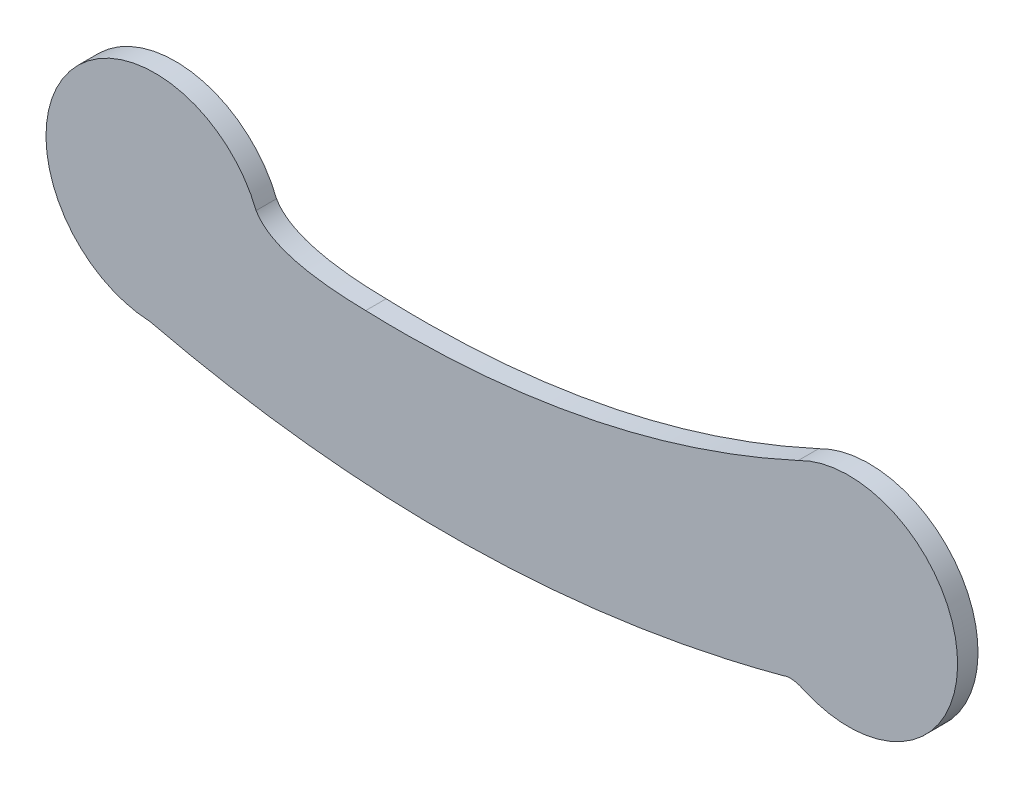
from build123d import *

# Parameters (mm, degrees)
SKETCH1_R           = 5
SKETCH1_R_2         = 1.1
SKETCH1_R_3         = 4
BOSS_EXTRUDE1_DEPTH = 3


with BuildPart() as part:
    # Sketch1 → Boss-Extrude1 (new body)
    # profile 1 of 19: a face of its own
    with BuildSketch(Plane.XY):
        with BuildLine():
            ThreePointArc((68.935876888, -41.399946265), (91.352405248, -26.204284986), (67.957252813, -12.563327983))
            add(Edge.make_bspline(
                [(67.957252813, -12.563327983), (65.455609859, -13.713888582), (60.364787712, -15.882927404), (52.683559955, -18.641296662), (44.896066709, -20.933273776), (37.015370972, -22.752952432), (29.033864031, -24.103049266), (20.950849492, -24.983508442), (14.12359191, -25.325141054), (8.614596461, -25.364124484), (5.82883012, -25.303122311), (4.440642397, -25.254725163)],
                knots=[0.003418543, 0.003418543, 0.003418543, 0.003418543, 0.119867337, 0.236316132, 0.352764926, 0.46921372, 0.585662514, 0.702111309, 0.818560103, 0.8767845, 0.935008897, 0.935008897, 0.935008897, 0.935008897], degree=3))
            add(Edge.make_bspline(
                [(-11.658277887, -20.5832063), (-9.065688302, -25.060046308), (4.440642397, -25.254725163)],
                knots=[0, 0, 0, 1, 1, 1], degree=2))
            ThreePointArc((-11.658277887, -20.5832063), (-39.551034339, -17.233624375), (-27.264419704, -42.497524754))
            add(Edge.make_bspline(
                [(-27.264419704, -42.497524754), (-25.334460253, -42.955768201), (-21.452320642, -43.816124737), (-13.705385842, -45.286858174), (-4.006421964, -46.667533574), (7.638269658, -47.586831656), (19.289241844, -47.768762722), (30.941925955, -47.212824411), (42.591601286, -45.920000504), (52.298162816, -44.228522597), (60.052175742, -42.510146288), (63.940283625, -41.52535362), (65.871739475, -41.00572578)],
                knots=[0.004189422, 0.004189422, 0.004189422, 0.004189422, 0.066427583, 0.128665745, 0.253142067, 0.377618389, 0.502094711, 0.626571033, 0.751047356, 0.875523678, 0.937761839, 1, 1, 1, 1], degree=3))
            add(Edge.make_bspline(
                [(68.935876888, -41.399946265), (67.056778784, -40.529280178), (65.871739475, -41.00572578)],
                knots=[0, 0, 0, 1, 1, 1], degree=2))
        make_face()
        with Locations((75.361610976, -26.74696222)):
            Circle(SKETCH1_R, mode=Mode.SUBTRACT)
        with Locations((75.361610976, -18.74696222)):
            Circle(SKETCH1_R_2, mode=Mode.SUBTRACT)
        with Locations((81.018465226, -21.090107971)):
            Circle(SKETCH1_R_2, mode=Mode.SUBTRACT)
        with Locations((83.361610976, -26.74696222)):
            Circle(SKETCH1_R_2, mode=Mode.SUBTRACT)
        with Locations((-26.518107506, -26.514939916)):
            Circle(SKETCH1_R_3, mode=Mode.SUBTRACT)
        with Locations((81.018465226, -32.40381647)):
            Circle(SKETCH1_R_2, mode=Mode.SUBTRACT)
        with Locations((-26.516504294, -18.516504294)):
            Circle(SKETCH1_R_2, mode=Mode.SUBTRACT)
        with Locations((-20.859650045, -20.859650045)):
            Circle(SKETCH1_R_2, mode=Mode.SUBTRACT)
        with Locations((-18.516504294, -26.516504294)):
            Circle(SKETCH1_R_2, mode=Mode.SUBTRACT)
        with Locations((-20.859650045, -32.173358544)):
            Circle(SKETCH1_R_2, mode=Mode.SUBTRACT)
        with Locations((-26.516504294, -34.516504294)):
            Circle(SKETCH1_R_2, mode=Mode.SUBTRACT)
        with Locations((-32.173358544, -32.173358544)):
            Circle(SKETCH1_R_2, mode=Mode.SUBTRACT)
        with Locations((-34.516504294, -26.516504294)):
            Circle(SKETCH1_R_2, mode=Mode.SUBTRACT)
        with Locations((-32.173358544, -20.859650045)):
            Circle(SKETCH1_R_2, mode=Mode.SUBTRACT)
        with Locations((75.361610976, -34.74696222)):
            Circle(SKETCH1_R_2, mode=Mode.SUBTRACT)
        with Locations((69.704756727, -32.40381647)):
            Circle(SKETCH1_R_2, mode=Mode.SUBTRACT)
        with Locations((67.361610976, -26.74696222)):
            Circle(SKETCH1_R_2, mode=Mode.SUBTRACT)
        with Locations((69.704756727, -21.090107971)):
            Circle(SKETCH1_R_2, mode=Mode.SUBTRACT)
    # profile 2 of 19: a face of its own
    with BuildSketch(Plane.XY):
        with Locations((-20.859650045, -20.859650045)):
            Circle(SKETCH1_R_2)
    # profile 3 of 19: a face of its own
    with BuildSketch(Plane.XY):
        with Locations((-26.516504294, -18.516504294)):
            Circle(SKETCH1_R_2)
    # profile 4 of 19: a face of its own
    with BuildSketch(Plane.XY):
        with Locations((-32.173358544, -20.859650045)):
            Circle(SKETCH1_R_2)
    # profile 5 of 19: a face of its own
    with BuildSketch(Plane.XY):
        with Locations((-18.516504294, -26.516504294)):
            Circle(SKETCH1_R_2)
    # profile 6 of 19: a face of its own
    with BuildSketch(Plane.XY):
        with Locations((-20.859650045, -32.173358544)):
            Circle(SKETCH1_R_2)
    # profile 7 of 19: a face of its own
    with BuildSketch(Plane.XY):
        with Locations((-26.516504294, -34.516504294)):
            Circle(SKETCH1_R_2)
    # profile 8 of 19: a face of its own
    with BuildSketch(Plane.XY):
        with Locations((-32.173358544, -32.173358544)):
            Circle(SKETCH1_R_2)
    # profile 9 of 19: a face of its own
    with BuildSketch(Plane.XY):
        with Locations((-34.516504294, -26.516504294)):
            Circle(SKETCH1_R_2)
    # profile 10 of 19: a face of its own
    with BuildSketch(Plane.XY):
        with Locations((-26.518107506, -26.514939916)):
            Circle(SKETCH1_R_3)
    # profile 11 of 19: a face of its own
    with BuildSketch(Plane.XY):
        with Locations((83.361610976, -26.74696222)):
            Circle(SKETCH1_R_2)
    # profile 12 of 19: a face of its own
    with BuildSketch(Plane.XY):
        with Locations((81.018465226, -21.090107971)):
            Circle(SKETCH1_R_2)
    # profile 13 of 19: a face of its own
    with BuildSketch(Plane.XY):
        with Locations((75.361610976, -18.74696222)):
            Circle(SKETCH1_R_2)
    # profile 14 of 19: a face of its own
    with BuildSketch(Plane.XY):
        with Locations((69.704756727, -21.090107971)):
            Circle(SKETCH1_R_2)
    # profile 15 of 19: a face of its own
    with BuildSketch(Plane.XY):
        with Locations((67.361610976, -26.74696222)):
            Circle(SKETCH1_R_2)
    # profile 16 of 19: a face of its own
    with BuildSketch(Plane.XY):
        with Locations((69.704756727, -32.40381647)):
            Circle(SKETCH1_R_2)
    # profile 17 of 19: a face of its own
    with BuildSketch(Plane.XY):
        with Locations((75.361610976, -34.74696222)):
            Circle(SKETCH1_R_2)
    # profile 18 of 19: a face of its own
    with BuildSketch(Plane.XY):
        with Locations((81.018465226, -32.40381647)):
            Circle(SKETCH1_R_2)
    # profile 19 of 19: a face of its own
    with BuildSketch(Plane.XY):
        with Locations((75.361610976, -26.74696222)):
            Circle(SKETCH1_R)
    extrude(amount=BOSS_EXTRUDE1_DEPTH)


solid = part.part
